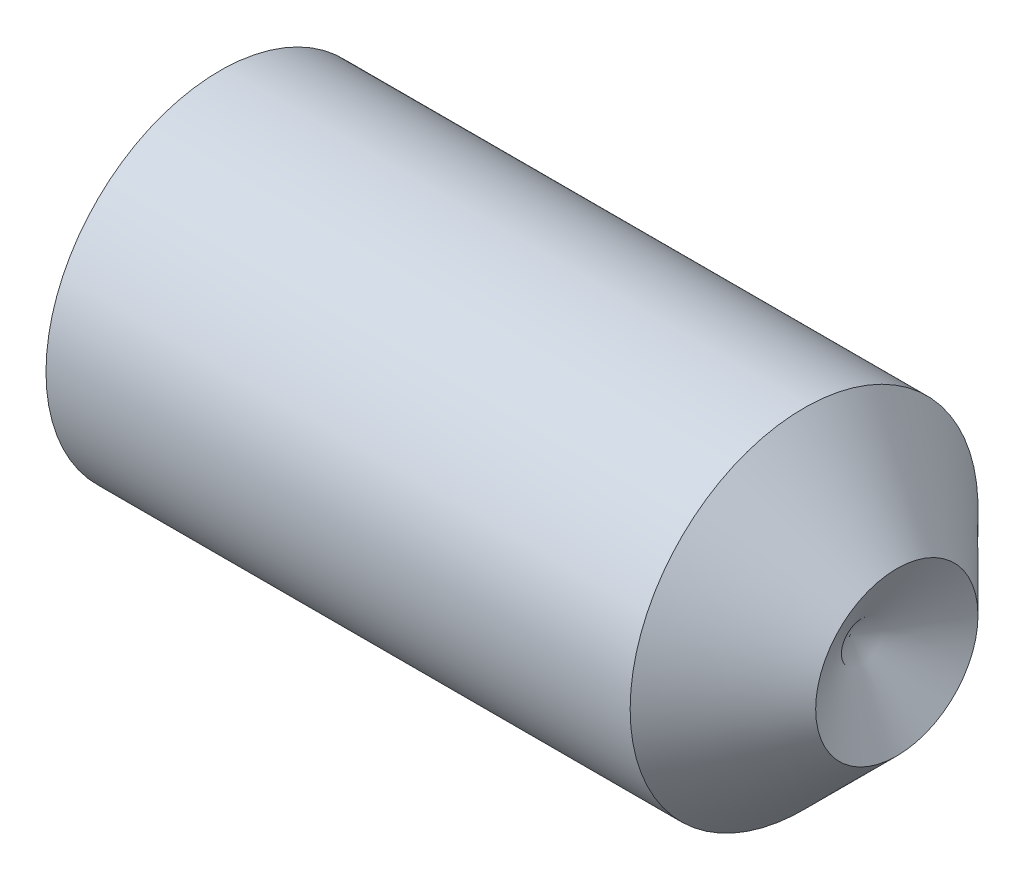
from build123d import *

# Parameters (mm, degrees)
HEX_2_DEPTH = 2


with BuildPart() as part:
    # BodySke → BaseBody (revolve)
    with BuildSketch(Plane.XY, mode=Mode.PRIVATE) as basebody_sk:
        Polygon((0, 0), (0, 1.2195), (0.161946751, 1.5), (5.2, 1.5), (6, 0.7), (5.595854812, 0), align=None)
    revolve(basebody_sk.sketch.rotate(Axis((-12.7, 0, 0), (1, 0, 0)), 90), axis=Axis((-12.7, 0, 0), (1, 0, 0)))

    # Sketch2 → Hex 2 (cut)
    with BuildSketch(Plane.ZY):
        Polygon((0.433012702, 0.75), (-0.433012702, 0.75), (-0.866025404, 0), (-0.433012702, -0.75), (0.433012702, -0.75), (0.866025404, 0), align=None)
    extrude(amount=-HEX_2_DEPTH, mode=Mode.SUBTRACT)


solid = part.part
